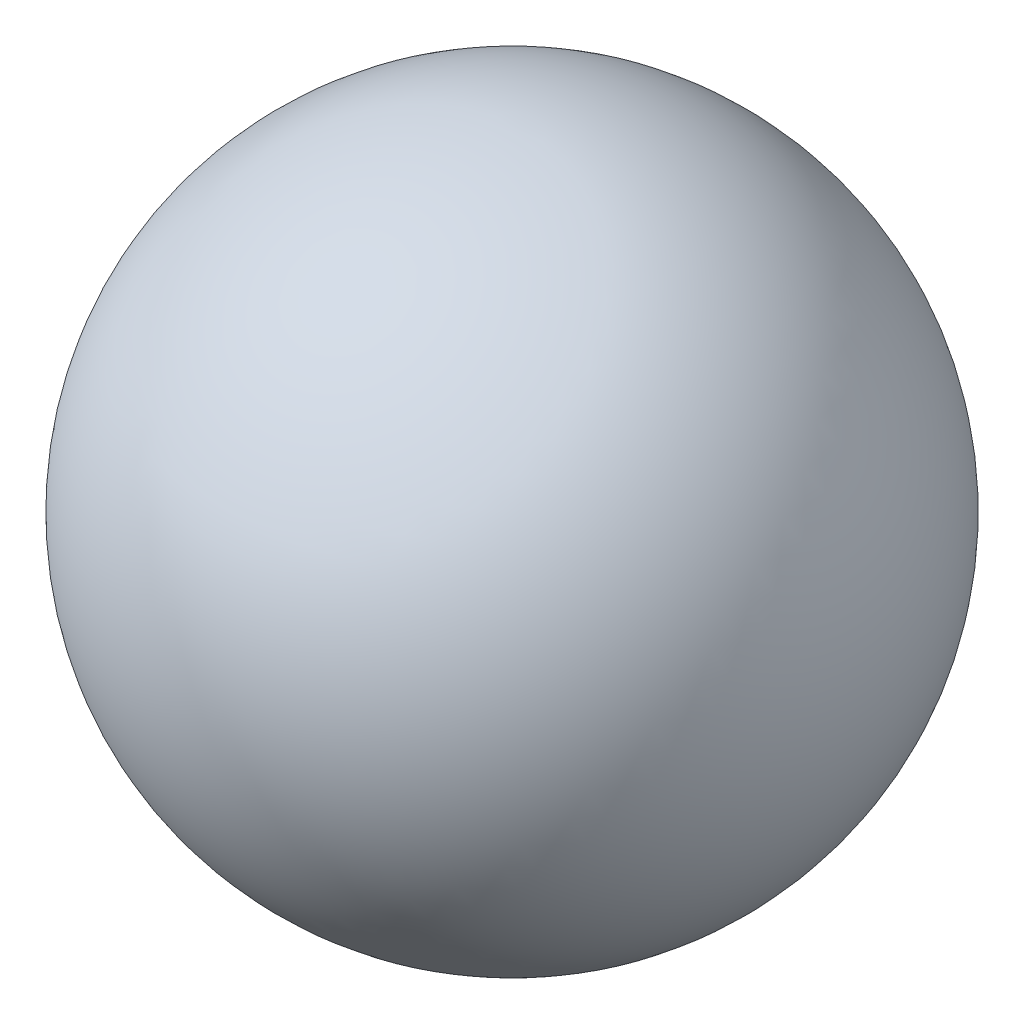
from build123d import *


with BuildPart() as part:
    # 草图1 → 旋转1 (revolve)
    with BuildSketch(Plane.XY):
        with BuildLine():
            Line((58.75, 14), (58.75, -14))
            ThreePointArc((58.75, -14), (72.75, 0), (58.75, 14))
        make_face()
    revolve(axis=Axis((58.75, 23.456254129, 0), (0, -1, 0)))


solid = part.part
